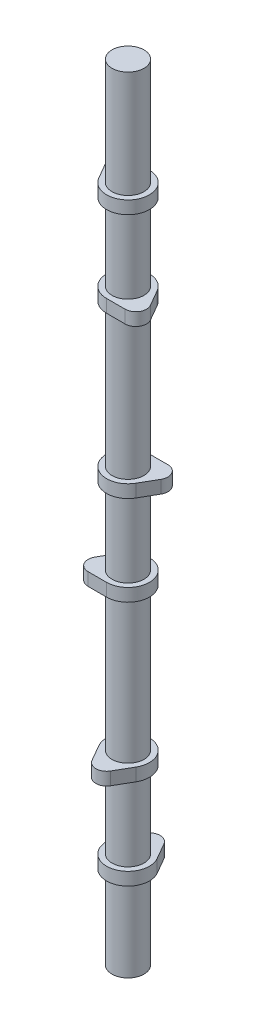
from build123d import *

# Parameters (mm, degrees)
BOSS_EXTRUDE1_DEPTH   = 7.62
LPATTERN1_COUNT       = 2
LPATTERN1_PITCH       = 53.34
BODY_MOVE_COPY2_ANGLE = 180
LPATTERN2_COUNT       = 3
LPATTERN2_PITCH       = 146.05
BODY_MOVE_COPY3_ANGLE = 120
BODY_MOVE_COPY4_ANGLE = 120
BOSS_EXTRUDE2_START   = -49.53
SKETCH2_R             = 9.5
BOSS_EXTRUDE2_DEPTH   = 466.09


with BuildPart() as part:
    # Sketch1 → Boss-Extrude1 (new body)
    with BuildSketch(Plane(origin=(0, 0, 0), x_dir=(1, 0, 0), z_dir=(0, 1, 0))):
        with BuildLine():
            Line((-5.499261314, 15.875), (-10.998522628, 6.35))
            ThreePointArc((-10.998522628, 6.35), (0, -12.7), (10.998522628, 6.35))
            Line((10.998522628, 6.35), (5.499261314, 15.875))
            ThreePointArc((5.499261314, 15.875), (0, 19.05), (-5.499261314, 15.875))
        make_face()
    extrude(amount=BOSS_EXTRUDE1_DEPTH)


with BuildPart() as lpattern1_1:
    # LPattern1: pattern copy
    add(part.part.moved(Location(Vector(0, 1, 0) * (1 * LPATTERN1_PITCH))))


with BuildPart() as lpattern1_1_1:
    # Body-Move/Copy2: moved
    add(lpattern1_1.part.rotate(Axis((0, 0, 0), (0, 1, 0)), BODY_MOVE_COPY2_ANGLE))


with BuildPart() as lpattern2_1:
    # LPattern2: pattern copy
    add(part.part.moved(Location(Vector(0, 1, 0) * (1 * LPATTERN2_PITCH))))


with BuildPart() as lpattern2_2:
    # LPattern2: pattern copy
    add(part.part.moved(Location(Vector(0, 1, 0) * (2 * LPATTERN2_PITCH))))


with BuildPart() as lpattern2_3:
    # LPattern2: pattern copy
    add(lpattern1_1_1.part.moved(Location(Vector(0, 1, 0) * (1 * LPATTERN2_PITCH))))


with BuildPart() as lpattern2_4:
    # LPattern2: pattern copy
    add(lpattern1_1_1.part.moved(Location(Vector(0, 1, 0) * (2 * LPATTERN2_PITCH))))


with BuildPart() as lpattern2_3_1:
    # Body-Move/Copy3: moved
    add(lpattern2_3.part.rotate(Axis((0, 0, 0), (0, 1, 0)), BODY_MOVE_COPY3_ANGLE))


with BuildPart() as lpattern2_1_1:
    # Body-Move/Copy3: moved
    add(lpattern2_1.part.rotate(Axis((0, 0, 0), (0, 1, 0)), BODY_MOVE_COPY3_ANGLE))


with BuildPart() as lpattern2_4_1:
    # Body-Move/Copy4: moved
    add(lpattern2_4.part.rotate(Axis((0, 0, 0), (0, -1, 0)), BODY_MOVE_COPY4_ANGLE))


with BuildPart() as lpattern2_2_1:
    # Body-Move/Copy4: moved
    add(lpattern2_2.part.rotate(Axis((0, 0, 0), (0, -1, 0)), BODY_MOVE_COPY4_ANGLE))


with BuildPart() as part_1:
    add(part.part)

    add(lpattern1_1_1.part)  # Boss-Extrude2 merges LPattern1_1

    add(lpattern2_1_1.part)  # Boss-Extrude2 merges LPattern2_1

    add(lpattern2_2_1.part)  # Boss-Extrude2 merges LPattern2_2

    add(lpattern2_3_1.part)  # Boss-Extrude2 merges LPattern2_3

    add(lpattern2_4_1.part)  # Boss-Extrude2 merges LPattern2_4
    # Sketch2 → Boss-Extrude2 (add)
    with BuildSketch(Plane(origin=(0, 0, 0), x_dir=(1, 0, 0), z_dir=(0, 1, 0)).offset(BOSS_EXTRUDE2_START)):
        Circle(SKETCH2_R)
    extrude(amount=BOSS_EXTRUDE2_DEPTH)


solid = part_1.part
